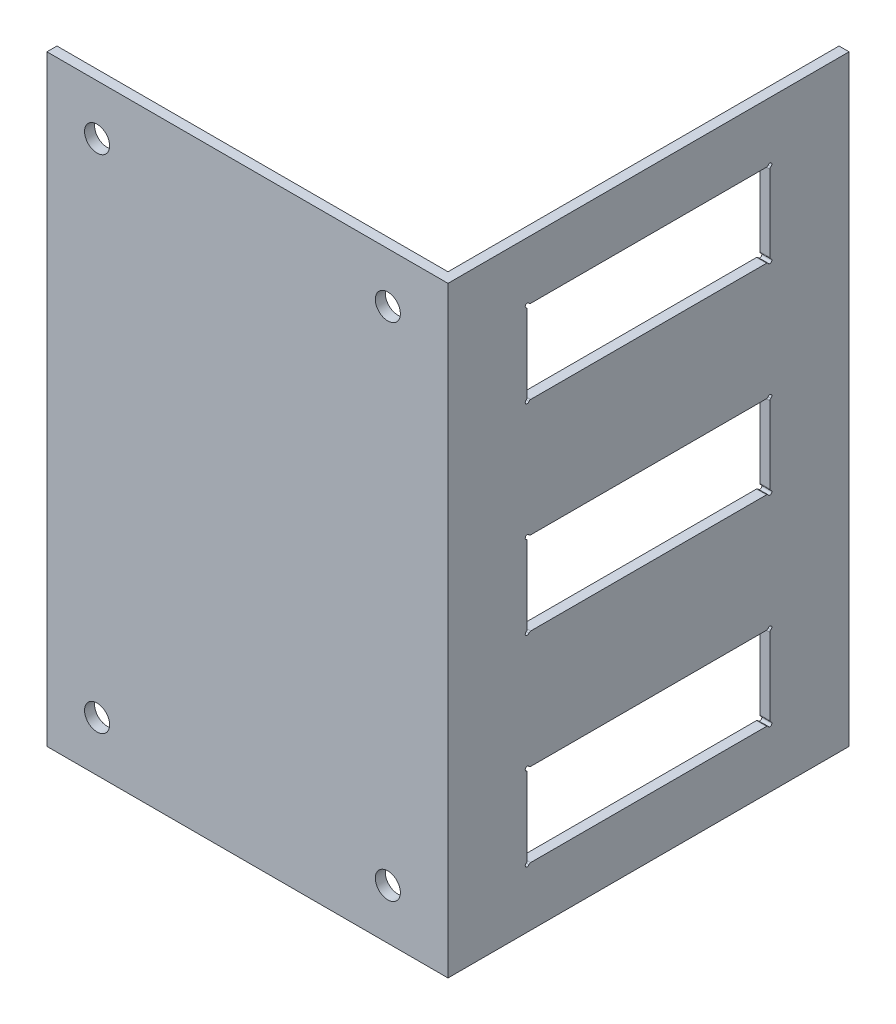
from build123d import *

# Parameters (mm, degrees)
BOSS_EXTRUDE1_DEPTH = 76.2
CUT_EXTRUDE1_DEPTH  = 105.116765701
SKETCH3_R           = 1.5875
CUT_EXTRUDE2_DEPTH  = 105.116765701


with BuildPart() as part:
    # Sketch1 → Boss-Extrude1 (new body)
    with BuildSketch(Plane(origin=(0, 0, 0), x_dir=(1, 0, 0), z_dir=(0, 1, 0))):
        Polygon((0, 0), (0, 1.27), (49.53, 1.27), (49.53, 50.8), (50.8, 50.8), (50.8, 0), align=None)
    extrude(amount=BOSS_EXTRUDE1_DEPTH)

    # Sketch2 → Cut-Extrude1 (cut, through all)
    with BuildSketch(Plane.ZY.offset(-49.53)):
        with BuildLine():
            ThreePointArc((-9.908, 58.446006351), (-9.856223305, 58.052723305), (-10.249506351, 58.1045))
            ThreePointArc((-10.249506351, 58.1045), (-10.341012702, 58.196006351), (-10.466012702, 58.2295))
            Line((-10.466012702, 58.2295), (-40.333987298, 58.2295))
            ThreePointArc((-40.333987298, 58.2295), (-40.458987298, 58.196006351), (-40.550493649, 58.1045))
            ThreePointArc((-40.550493649, 58.1045), (-40.943776695, 58.052723305), (-40.892, 58.446006351))
            ThreePointArc((-40.892, 58.446006351), (-40.800493649, 58.537512702), (-40.767, 58.662512702))
            Line((-40.767, 58.662512702), (-40.767, 68.337487298))
            ThreePointArc((-40.767, 68.337487298), (-40.800493649, 68.462487298), (-40.892, 68.553993649))
            ThreePointArc((-40.892, 68.553993649), (-40.943776695, 68.947276695), (-40.550493649, 68.8955))
            ThreePointArc((-40.550493649, 68.8955), (-40.458987298, 68.803993649), (-40.333987298, 68.7705))
            Line((-40.333987298, 68.7705), (-10.466012702, 68.7705))
            ThreePointArc((-10.466012702, 68.7705), (-10.341012702, 68.803993649), (-10.249506351, 68.8955))
            ThreePointArc((-10.249506351, 68.8955), (-9.856223305, 68.947276695), (-9.908, 68.553993649))
            ThreePointArc((-9.908, 68.553993649), (-9.999506351, 68.462487298), (-10.033, 68.337487298))
            Line((-10.033, 68.337487298), (-10.033, 58.662512702))
            ThreePointArc((-10.033, 58.662512702), (-9.999506351, 58.537512702), (-9.908, 58.446006351))
        make_face()
        with BuildLine():
            ThreePointArc((-9.908, 33.046006351), (-9.856223305, 32.652723305), (-10.249506351, 32.7045))
            ThreePointArc((-10.249506351, 32.7045), (-10.341012702, 32.796006351), (-10.466012702, 32.8295))
            Line((-10.466012702, 32.8295), (-40.333987298, 32.8295))
            ThreePointArc((-40.333987298, 32.8295), (-40.458987298, 32.796006351), (-40.550493649, 32.7045))
            ThreePointArc((-40.550493649, 32.7045), (-40.943776695, 32.652723305), (-40.892, 33.046006351))
            ThreePointArc((-40.892, 33.046006351), (-40.800493649, 33.137512702), (-40.767, 33.262512702))
            Line((-40.767, 33.262512702), (-40.767, 42.937487298))
            ThreePointArc((-40.767, 42.937487298), (-40.800493649, 43.062487298), (-40.892, 43.153993649))
            ThreePointArc((-40.892, 43.153993649), (-40.943776695, 43.547276695), (-40.550493649, 43.4955))
            ThreePointArc((-40.550493649, 43.4955), (-40.458987298, 43.403993649), (-40.333987298, 43.3705))
            Line((-40.333987298, 43.3705), (-10.466012702, 43.3705))
            ThreePointArc((-10.466012702, 43.3705), (-10.341012702, 43.403993649), (-10.249506351, 43.4955))
            ThreePointArc((-10.249506351, 43.4955), (-9.856223305, 43.547276695), (-9.908, 43.153993649))
            ThreePointArc((-9.908, 43.153993649), (-9.999506351, 43.062487298), (-10.033, 42.937487298))
            Line((-10.033, 42.937487298), (-10.033, 33.262512702))
            ThreePointArc((-10.033, 33.262512702), (-9.999506351, 33.137512702), (-9.908, 33.046006351))
        make_face()
        with BuildLine():
            ThreePointArc((-9.908, 7.646006351), (-9.856223305, 7.252723305), (-10.249506351, 7.3045))
            ThreePointArc((-10.249506351, 7.3045), (-10.341012702, 7.396006351), (-10.466012702, 7.4295))
            Line((-10.466012702, 7.4295), (-40.333987298, 7.4295))
            ThreePointArc((-40.333987298, 7.4295), (-40.458987298, 7.396006351), (-40.550493649, 7.3045))
            ThreePointArc((-40.550493649, 7.3045), (-40.943776695, 7.252723305), (-40.892, 7.646006351))
            ThreePointArc((-40.892, 7.646006351), (-40.800493649, 7.737512702), (-40.767, 7.862512702))
            Line((-40.767, 7.862512702), (-40.767, 17.537487298))
            ThreePointArc((-40.767, 17.537487298), (-40.800493649, 17.662487298), (-40.892, 17.753993649))
            ThreePointArc((-40.892, 17.753993649), (-40.943776695, 18.147276695), (-40.550493649, 18.0955))
            ThreePointArc((-40.550493649, 18.0955), (-40.458987298, 18.003993649), (-40.333987298, 17.9705))
            Line((-40.333987298, 17.9705), (-10.466012702, 17.9705))
            ThreePointArc((-10.466012702, 17.9705), (-10.341012702, 18.003993649), (-10.249506351, 18.0955))
            ThreePointArc((-10.249506351, 18.0955), (-9.856223305, 18.147276695), (-9.908, 17.753993649))
            ThreePointArc((-9.908, 17.753993649), (-9.999506351, 17.662487298), (-10.033, 17.537487298))
            Line((-10.033, 17.537487298), (-10.033, 7.862512702))
            ThreePointArc((-10.033, 7.862512702), (-9.999506351, 7.737512702), (-9.908, 7.646006351))
        make_face()
    extrude(amount=-CUT_EXTRUDE1_DEPTH, mode=Mode.SUBTRACT)

    # Sketch3 → Cut-Extrude2 (cut, through all)
    with BuildSketch(Plane(origin=(0, 0, -1.27), x_dir=(-1, 0, 0), z_dir=(0, 0, -1))):
        with Locations((-6.35, 69.85)):
            Circle(SKETCH3_R)
        with Locations((-6.35, 6.35)):
            Circle(SKETCH3_R)
        with Locations((-43.18, 6.35)):
            Circle(SKETCH3_R)
        with Locations((-43.18, 69.85)):
            Circle(SKETCH3_R)
    extrude(amount=-CUT_EXTRUDE2_DEPTH, mode=Mode.SUBTRACT)


solid = part.part
